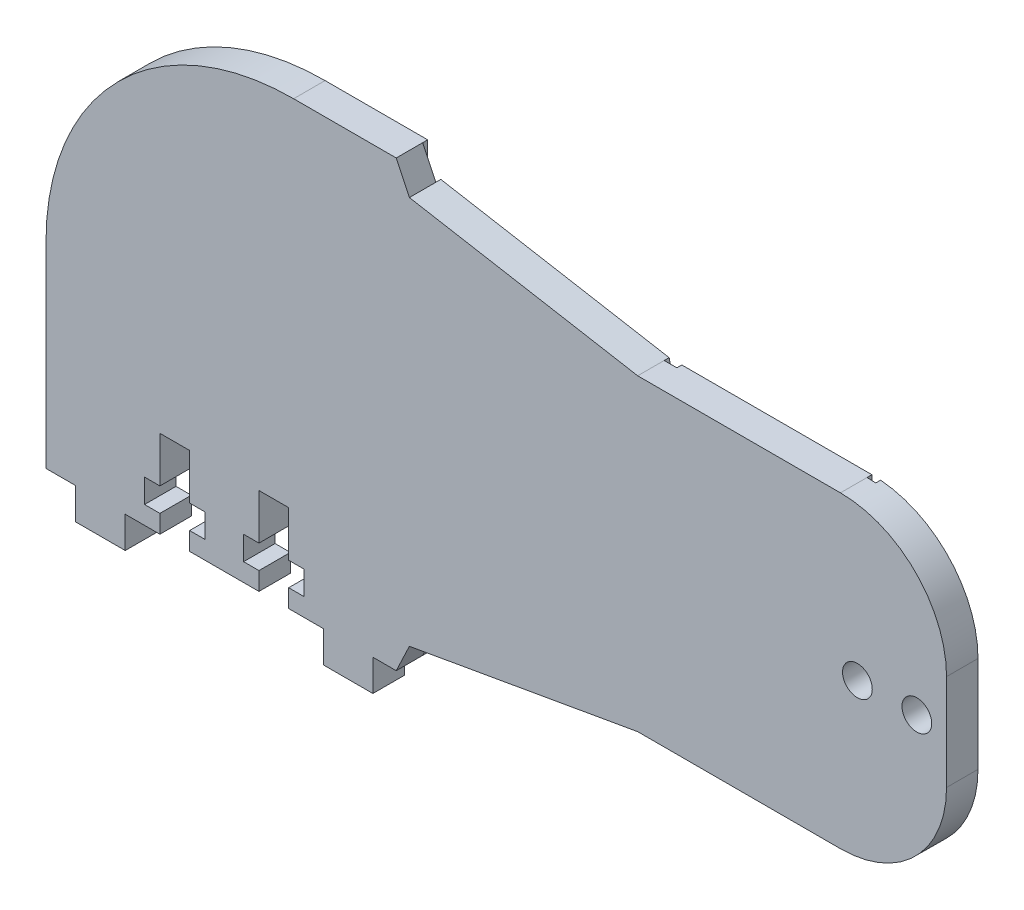
from build123d import *

# Parameters (mm, degrees)
BOSS_EXTRUDE1_DEPTH = 3.175
SKETCH2_W           = 5
SKETCH2_H           = 3.175
BOSS_EXTRUDE2_DEPTH = 3.175
CUT_EXTRUDE1_DEPTH  = 93.974208943
CUT_EXTRUDE4_DEPTH  = 0.5
CUT_EXTRUDE5_DEPTH  = 93.974208943
SKETCH6_R           = 1.5
CUT_EXTRUDE6_DEPTH  = 93.974208943


with BuildPart() as part:
    # Sketch1 → Boss-Extrude1 (new body)
    with BuildSketch(Plane.XY):
        with BuildLine():
            Line((70.685056323, 37.961813727), (50.215098345, 37.961813727))
            Line((50.215098345, 37.961813727), (27.166207813, 42.019918966))
            Line((27.166207813, 42.019918966), (25.837789145, 44.817651071))
            Line((25.837789145, 44.817651071), (-9.51883745, 44.817651071))
            Line((-9.51883745, 44.817651071), (-9.51883745, -0.009767361))
            Line((-9.51883745, -0.009767361), (25.837789145, -0.009767361))
            Line((25.837789145, -0.009767361), (27.166207813, 2.787964744))
            Line((27.166207813, 2.787964744), (50.215098345, 6.846069984))
            Line((50.215098345, 6.846069984), (70.685056323, 6.846069984))
            ThreePointArc((70.685056323, 6.846069984), (78.259672242, 9.983578627), (81.397180885, 17.558194546))
            Line((81.397180885, 17.558194546), (81.397180885, 22.403941855))
            Line((81.397180885, 22.403941855), (81.397180885, 27.249689164))
            ThreePointArc((81.397180885, 27.249689164), (78.259672242, 34.824305083), (70.685056323, 37.961813727))
        make_face()
    extrude(amount=BOSS_EXTRUDE1_DEPTH)

    # Sketch2 → Boss-Extrude2 (add)
    with BuildSketch(Plane.XY.offset(3.175)):
        with Locations((-4.01883745, -1.597267361)):
            Rectangle(SKETCH2_W, SKETCH2_H)
        with Locations((20.98116255, -1.597267361)):
            Rectangle(SKETCH2_W, SKETCH2_H)
    extrude(amount=-BOSS_EXTRUDE2_DEPTH)

    # Sketch3 → Cut-Extrude1 (cut, through all)
    with BuildSketch(Plane.XY.offset(3.175)):
        Polygon((4.98116255, -0.009767361), (1.98116255, -0.009767361), (1.98116255, 1.815232639), (0.43116255, 1.815232639), (0.43116255, 4.215232639), (1.98116255, 4.215232639), (1.98116255, 8.815232639), (4.98116255, 8.815232639), (4.98116255, 4.215232639), (6.53116255, 4.215232639), (6.53116255, 1.815232639), (4.98116255, 1.815232639), align=None)
        Polygon((11.98116255, -0.009767361), (11.98116255, 1.815232639), (10.43116255, 1.815232639), (10.43116255, 4.215232639), (11.98116255, 4.215232639), (11.98116255, 8.815232639), (14.98116255, 8.815232639), (14.98116255, 4.215232639), (16.53116255, 4.215232639), (16.53116255, 1.815232639), (14.98116255, 1.815232639), (14.98116255, -0.009767361), align=None)
    extrude(amount=-CUT_EXTRUDE1_DEPTH, mode=Mode.SUBTRACT)

    # Sketch4 → Cut-Extrude4 (cut)
    with BuildSketch(Plane.XY):
        Polygon((25.837789145, 22.403941855), (27.166207813, 22.403941855), (27.166207813, 42.019918966), (25.837789145, 44.817651071), align=None)
        Polygon((27.166207813, 2.787964744), (27.166207813, 22.403941855), (25.837789145, 22.403941855), (25.837789145, -0.009767361), align=None)
        with BuildLine():
            Line((50.215098345, 6.846069984), (51.495792338, 6.846069984))
            ThreePointArc((51.495792338, 6.846069984), (53.570887609, 22.403941855), (51.495792338, 37.961813727))
            Line((51.495792338, 37.961813727), (50.215098345, 37.961813727))
            ThreePointArc((50.215098345, 37.961813727), (52.343297045, 22.403941855), (50.215098345, 6.846069984))
        make_face()
        with BuildLine():
            Line((70.685056323, 37.961813727), (70.685056323, 6.846069984))
            ThreePointArc((70.685056323, 6.846069984), (71.126055593, 6.855151414), (71.56630713, 6.882380308))
            Line((71.56630713, 6.882380308), (71.56630713, 37.925503403))
            ThreePointArc((71.56630713, 37.925503403), (71.126055593, 37.952732296), (70.685056323, 37.961813727))
        make_face()
    extrude(amount=CUT_EXTRUDE4_DEPTH, mode=Mode.SUBTRACT)

    # Sketch5 → Cut-Extrude5 (cut, through all)
    with BuildSketch(Plane.XY.offset(3.175)):
        with BuildLine():
            Line((15.48116255, 44.817651071), (-9.51883745, 44.817651071))
            Line((-9.51883745, 44.817651071), (-9.51883745, 19.817651071))
            ThreePointArc((-9.51883745, 19.817651071), (-2.196506979, 37.495320601), (15.48116255, 44.817651071))
        make_face()
    extrude(amount=-CUT_EXTRUDE5_DEPTH, mode=Mode.SUBTRACT)

    # Sketch6 → Cut-Extrude6 (cut, through all)
    with BuildSketch(Plane.XY.offset(3.175)):
        with Locations((78.397180885, 22.403941855)):
            Circle(SKETCH6_R)
        with Locations((72.397180885, 22.403941855)):
            Circle(SKETCH6_R)
    extrude(amount=-CUT_EXTRUDE6_DEPTH, mode=Mode.SUBTRACT)


solid = part.part
